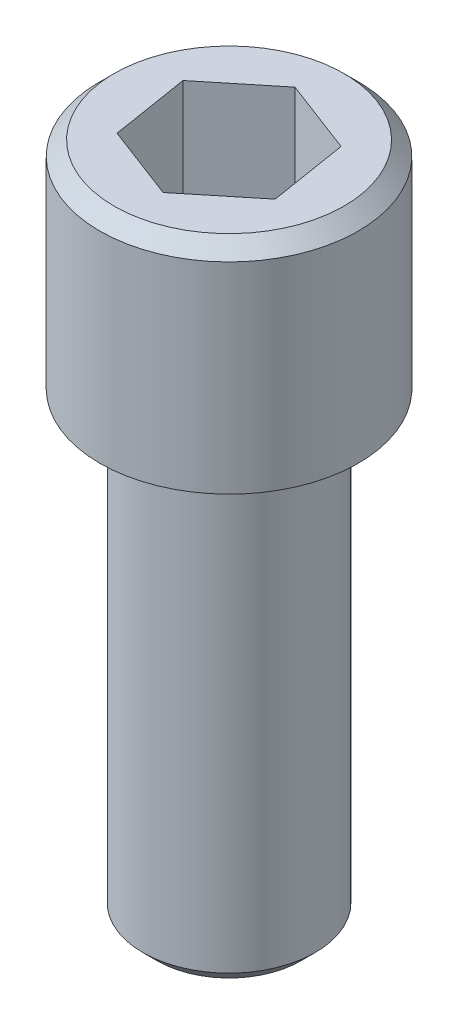
from build123d import *

# Parameters (mm, degrees)
SKICA1_R                 = 1.5
P_IDAT_VYSUNUT_M1_DEPTH  = 8
SKICA2_R                 = 2.25
P_IDAT_VYSUNUT_M2_DEPTH  = 3.75
ODEBRAT_VYSUNUT_M1_DEPTH = 2.25
ZKOSEN_1_SIZE            = 0.25
ZKOSEN_2_SIZE            = 0.25


with BuildPart() as part:
    # Skica1 → Přidat vysunutím1 (new body)
    with BuildSketch(Plane(origin=(0, 0, 0), x_dir=(1, 0, 0), z_dir=(0, 1, 0))):
        with Locations(Location((0, 0, 0), (0, 0, 270))):
            Circle(SKICA1_R)
    extrude(amount=P_IDAT_VYSUNUT_M1_DEPTH)

    # Skica2 → Přidat vysunutím2 (add)
    with BuildSketch(Plane(origin=(0, 8, 0), x_dir=(1, 0, 0), z_dir=(0, 1, 0))):
        with Locations(Location((0, 0, 0), (0, 0, 270))):
            Circle(SKICA2_R)
    extrude(amount=P_IDAT_VYSUNUT_M2_DEPTH)

    # Skica3 → Odebrat vysunutím1 (cut)
    with BuildSketch(Plane(origin=(0, 11.75, 0), x_dir=(1, 0, 0), z_dir=(0, 1, 0))):
        Polygon((-1.074402598, -0.875019461), (0.220587783, -1.367969674), (1.294990381, -0.492950213), (1.074402598, 0.875019461), (-0.220587783, 1.367969674), (-1.294990381, 0.492950213), align=None)
    extrude(amount=-ODEBRAT_VYSUNUT_M1_DEPTH, mode=Mode.SUBTRACT)

    # Zkosení1
    zkosen_1_edges = [part.edges().sort_by_distance(p)[0] for p in [
        (0, 11.75, -2.25),
    ]]
    chamfer(zkosen_1_edges, length=ZKOSEN_1_SIZE)

    # Zkosení2
    zkosen_2_edges = [part.edges().sort_by_distance(p)[0] for p in [
        (0, 0, -1.5),
    ]]
    chamfer(zkosen_2_edges, length=ZKOSEN_2_SIZE)


solid = part.part
